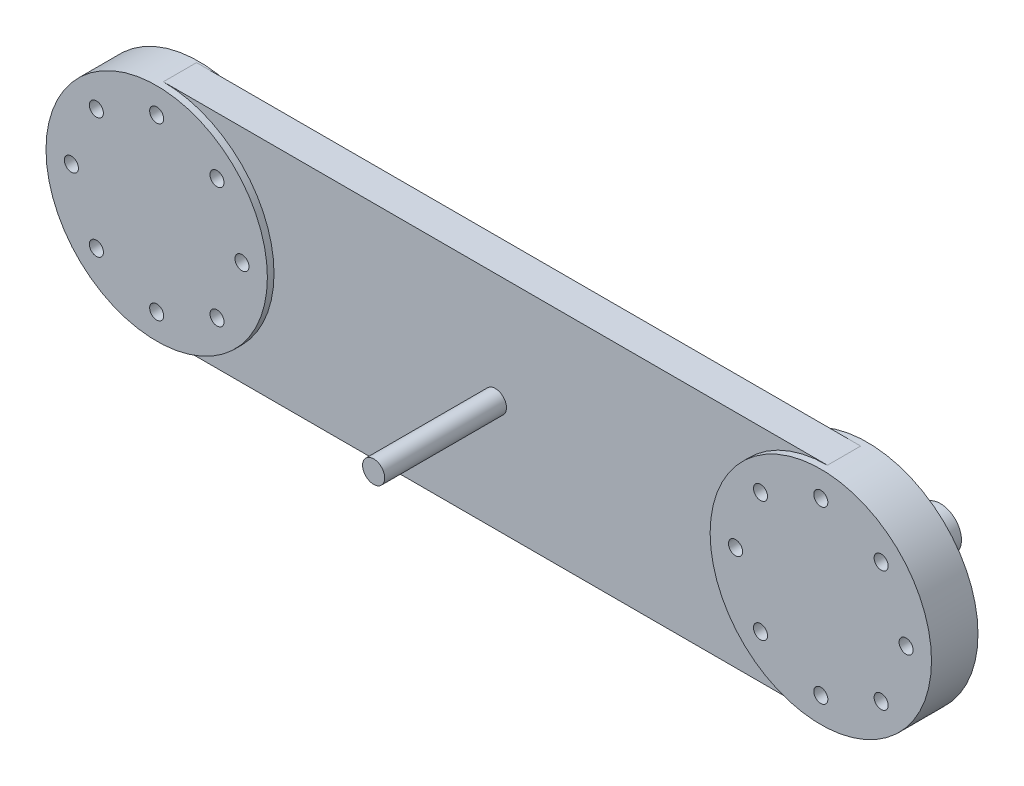
from build123d import *
from build123d.topology import SkipClean

# Parameters (mm, degrees)
SKETCH_1_R                         = 50
EXTRUDE_18_DEPTH                   = 13
EXTRUDE_18_2_DEPTH                 = 13
SKETCH_1_28_W                      = 300
SKETCH_1_28_H                      = 100
EXTRUDE_21_DEPTH                   = 15
SKETCH_1_30_R                      = 5
EXTRUDE_22_DEPTH                   = 70
SKETCH_1_31_R                      = 50
CUT_EXTRUDE_2_DEPTH                = 41
EXTRUDE_23_DEPTH                   = 18
EXTRUDE_23_DEPTH_BACK              = 1
SKETCH_1_32_R                      = 50
CUT_EXTRUDE_5_DEPTH                = 130
CUT_EXTRUDE_5_DEPTH_BACK           = 69
SKETCH_1_35_R                      = 3.175
SKETCH_1_36_R                      = 50
CUT_EXTRUDE_6_DEPTH                = 34
EXTRUDE_24_DEPTH                   = 18
EXTRUDE_24_DEPTH_BACK              = 3
SKETCH_1_37_R                      = 50
CUT_EXTRUDE_7_DEPTH                = 87
CUT_EXTRUDE_7_DEPTH_BACK           = 98
SKETCH_1_41_R                      = 3.175
THE_EXTENDED_SHAFT_CONNECTER_DEPTH = 36
SKETCH_3_R                         = 1.5875
CUT_EXTRUDE_8_DEPTH                = 31
SCREW_HOLES2_REACH                 = 372.675
SCREW_HOLES2_END_RADIUS            = 6.25
SKETCH_5_R                         = 1.5875


with BuildPart() as part:
    # 草图1 → 凸台-拉伸18 (new body)
    with BuildSketch(Plane.XY):
        with Locations(Location((0, 50, 0), (0, 0, 180))):
            Circle(SKETCH_1_R)
    extrude(amount=EXTRUDE_18_DEPTH)



with BuildPart() as body_2:
    # 草图1 → Extrude 18 2 (new body)
    with BuildSketch(Plane.XY):
        with Locations(Location((-300, 50, 0), (0, 0, 180))):
            Circle(SKETCH_1_R)
    extrude(amount=EXTRUDE_18_2_DEPTH)


with BuildPart() as part_1:
    add(part.part)

    add(body_2.part)  # 凸台-拉伸21 merges body 2
    # 草图1<28> → 凸台-拉伸21 (add)
    with BuildSketch(Plane.XY):
        with Locations((-150, 50)):
            Rectangle(SKETCH_1_28_W, SKETCH_1_28_H)
    extrude(amount=EXTRUDE_21_DEPTH)

    # 草图1<30> → 凸台-拉伸22 (add)
    with BuildSketch(Plane.XY):
        with Locations((-150, 50)):
            Circle(SKETCH_1_30_R)
    extrude(amount=EXTRUDE_22_DEPTH)

    # 草图1<31> → 切除-拉伸2 (cut)
    with BuildSketch(Plane.XY):
        with Locations((-300, 50)):
            Circle(SKETCH_1_31_R)
    extrude(amount=CUT_EXTRUDE_2_DEPTH, mode=Mode.SUBTRACT)

    # 草图1<32> → 凸台-拉伸23 (add, two sides: drawn at the far end of the back side and taken through both)
    with BuildSketch(Plane.XY.offset(-EXTRUDE_23_DEPTH_BACK)):
        with Locations((-300, 50)):
            Circle(SKETCH_1_32_R)
    extrude(amount=EXTRUDE_23_DEPTH + EXTRUDE_23_DEPTH_BACK)

    # 草图1<35> → 切除-拉伸5 (cut, two sides: drawn at the far end of the back side and taken through both)
    with BuildSketch(Plane.XY.offset(-CUT_EXTRUDE_5_DEPTH_BACK)):
        with Locations((-261.469660941, 50)):
            Circle(SKETCH_1_35_R)
    extrude(amount=CUT_EXTRUDE_5_DEPTH + CUT_EXTRUDE_5_DEPTH_BACK, mode=Mode.SUBTRACT)

    # 草图1<36> → 切除-拉伸6 (cut)
    with BuildSketch(Plane.XY):
        with Locations((0, 50)):
            Circle(SKETCH_1_36_R)
    extrude(amount=CUT_EXTRUDE_6_DEPTH, mode=Mode.SUBTRACT)

    # 草图1<37> → 凸台-拉伸24 (add, two sides: drawn at the far end of the back side and taken through both)
    with BuildSketch(Plane.XY.offset(-EXTRUDE_24_DEPTH_BACK)):
        with Locations((0, 50)):
            Circle(SKETCH_1_37_R)
    extrude(amount=EXTRUDE_24_DEPTH + EXTRUDE_24_DEPTH_BACK)

    # 草图1<41> → 切除-拉伸7 (cut, two sides: drawn at the far end of the back side and taken through both)
    with BuildSketch(Plane.XY.offset(-CUT_EXTRUDE_7_DEPTH_BACK)):
        with Locations((-272.75493597, 77.24506403)):
            Circle(SKETCH_1_41_R)
        with BuildLine():
            ThreePointArc((-296.825, 88.530339059), (-297.75493597, 90.77540309), (-300, 91.705339059))
            Line((-300, 91.705339059), (-300, 85.355339059))
            ThreePointArc((-300, 85.355339059), (-297.75493597, 86.285275029), (-296.825, 88.530339059))
        make_face()
        with BuildLine():
            Line((-300, 85.355339059), (-300, 91.705339059))
            ThreePointArc((-300, 91.705339059), (-303.175, 88.530339059), (-300, 85.355339059))
        make_face()
        with Locations((-327.24506403, 77.24506403)):
            Circle(SKETCH_1_41_R)
        with Locations((-338.530339059, 50)):
            Circle(SKETCH_1_41_R)
        with BuildLine():
            ThreePointArc((-325, 25), (-329.490128061, 25), (-329.490128061, 20.509871939))
            Line((-329.490128061, 20.509871939), (-325, 25))
        make_face()
        with BuildLine():
            Line((-325, 25), (-329.490128061, 20.509871939))
            ThreePointArc((-329.490128061, 20.509871939), (-326.030044133, 19.821618454), (-324.07006403, 22.75493597))
            ThreePointArc((-324.07006403, 22.75493597), (-324.311746515, 23.969955867), (-325, 25))
        make_face()
        with BuildLine():
            ThreePointArc((-300, 14.644660941), (-303.175, 11.469660941), (-300, 8.294660941))
            Line((-300, 8.294660941), (-300, 14.644660941))
        make_face()
        with BuildLine():
            Line((-300, 14.644660941), (-300, 8.294660941))
            ThreePointArc((-300, 8.294660941), (-297.75493597, 9.22459691), (-296.825, 11.469660941))
            ThreePointArc((-296.825, 11.469660941), (-297.75493597, 13.714724971), (-300, 14.644660941))
        make_face()
        with Locations((-272.75493597, 22.75493597)):
            Circle(SKETCH_1_41_R)
        with BuildLine():
            ThreePointArc((-264.644660941, 50), (-261.469660941, 46.825), (-258.294660941, 50))
            Line((-258.294660941, 50), (-264.644660941, 50))
        make_face()
        with BuildLine():
            Line((-264.644660941, 50), (-258.294660941, 50))
            ThreePointArc((-258.294660941, 50), (-261.469660941, 53.175), (-264.644660941, 50))
        make_face()
        with Locations((-27.24506403, 22.75493597)):
            Circle(SKETCH_1_41_R)
        with Locations((-38.530339059, 50)):
            Circle(SKETCH_1_41_R)
        with Locations((-27.24506403, 77.24506403)):
            Circle(SKETCH_1_41_R)
        with BuildLine():
            ThreePointArc((3.175, 88.530339059), (2.24506403, 90.77540309), (0, 91.705339059))
            Line((0, 91.705339059), (0, 85.355339059))
            ThreePointArc((0, 85.355339059), (2.24506403, 86.285275029), (3.175, 88.530339059))
        make_face()
        with BuildLine():
            Line((0, 85.355339059), (0, 91.705339059))
            ThreePointArc((0, 91.705339059), (-3.175, 88.530339059), (0, 85.355339059))
        make_face()
        with Locations((27.24506403, 77.24506403)):
            Circle(SKETCH_1_41_R)
        with Locations((27.24506403, 22.75493597)):
            Circle(SKETCH_1_41_R)
        with Locations((38.530339059, 50)):
            Circle(SKETCH_1_41_R)
        with BuildLine():
            ThreePointArc((0, 14.644660941), (-3.175, 11.469660941), (0, 8.294660941))
            Line((0, 8.294660941), (0, 14.644660941))
        make_face()
        with BuildLine():
            Line((0, 14.644660941), (0, 8.294660941))
            ThreePointArc((0, 8.294660941), (2.24506403, 9.22459691), (3.175, 11.469660941))
            ThreePointArc((3.175, 11.469660941), (2.24506403, 13.714724971), (0, 14.644660941))
        make_face()
    extrude(amount=CUT_EXTRUDE_7_DEPTH + CUT_EXTRUDE_7_DEPTH_BACK, mode=Mode.SUBTRACT)

    # 草图1<43> → the extended shaft connecter (add)
    with BuildSketch(Plane.XY):
        with BuildLine():
            Line((0, 43.75), (0, 40.475))
            ThreePointArc((0, 40.475), (6.735192091, 43.264807909), (9.525, 50))
            ThreePointArc((9.525, 50), (6.735192091, 56.735192091), (0, 59.525))
            Line((0, 59.525), (0, 56.25))
            ThreePointArc((0, 56.25), (3.642600233, 55.078775791), (5.919983963, 52.004068333))
            Line((5.919983963, 52.004068333), (6.25, 52.004068333))
            Line((6.25, 52.004068333), (8.25, 52.004068333))
            Line((8.25, 52.004068333), (8.25, 50))
            Line((8.25, 50), (8.25, 47.995931667))
            Line((8.25, 47.995931667), (6.25, 47.995931667))
            Line((6.25, 47.995931667), (5.919983963, 47.995931667))
            ThreePointArc((5.919983963, 47.995931667), (3.642600233, 44.921224209), (0, 43.75))
        make_face()
        with BuildLine():
            ThreePointArc((0, 59.525), (-9.525, 50), (0, 40.475))
            Line((0, 40.475), (0, 43.75))
            ThreePointArc((0, 43.75), (-6.25, 50), (0, 56.25))
            Line((0, 56.25), (0, 59.525))
        make_face()
    extrude(amount=-THE_EXTENDED_SHAFT_CONNECTER_DEPTH)

    # 草图3 → 切除-拉伸8 (cut)
    with BuildSketch(Plane(origin=(0, 0, 0), x_dir=(0, 0, -1), z_dir=(1, 0, 0))):
        with Locations((32, 50)):
            Circle(SKETCH_3_R)
        with Locations((25, 50)):
            Circle(SKETCH_3_R)
    extrude(amount=-CUT_EXTRUDE_8_DEPTH, mode=Mode.SUBTRACT)

    # screw_holes2: up to this cylinder (the profile starts outside it)
    with SkipClean():  # the faces are left unmerged after this step: merging them gives an invalid solid
        screw_holes2_end = Plane(origin=(0, 50, -28.5), z_dir=(0, 0, 1)) * Cylinder(SCREW_HOLES2_END_RADIUS, 765.85, mode=Mode.PRIVATE)
        # 草图5 → screw_holes2 (cut, up to the surface)
        with BuildSketch(Plane(origin=(0, 0, 0), x_dir=(1, 0, 0), z_dir=(0, 1, 0)), mode=Mode.PRIVATE) as screw_holes2_sk1:
            with Locations(Location((0, 32, 0), (0, 0, 90))):
                Circle(SKETCH_5_R)
        screw_holes2_tool1 = extrude(screw_holes2_sk1.sketch, amount=SCREW_HOLES2_REACH, mode=Mode.PRIVATE) - screw_holes2_end
        add(screw_holes2_tool1.solids().sort_by_distance((0, 0, -32))[0], mode=Mode.SUBTRACT)
        # 草图5 → screw_holes2 (cut, up to the surface)
        with BuildSketch(Plane(origin=(0, 0, 0), x_dir=(1, 0, 0), z_dir=(0, 1, 0)), mode=Mode.PRIVATE) as screw_holes2_sk2:
            with Locations(Location((0, 25, 0), (0, 0, 90))):
                Circle(SKETCH_5_R)
        screw_holes2_tool2 = extrude(screw_holes2_sk2.sketch, amount=SCREW_HOLES2_REACH, mode=Mode.PRIVATE) - screw_holes2_end
        add(screw_holes2_tool2.solids().sort_by_distance((0, 0, -25))[0], mode=Mode.SUBTRACT)


solid = part_1.part
